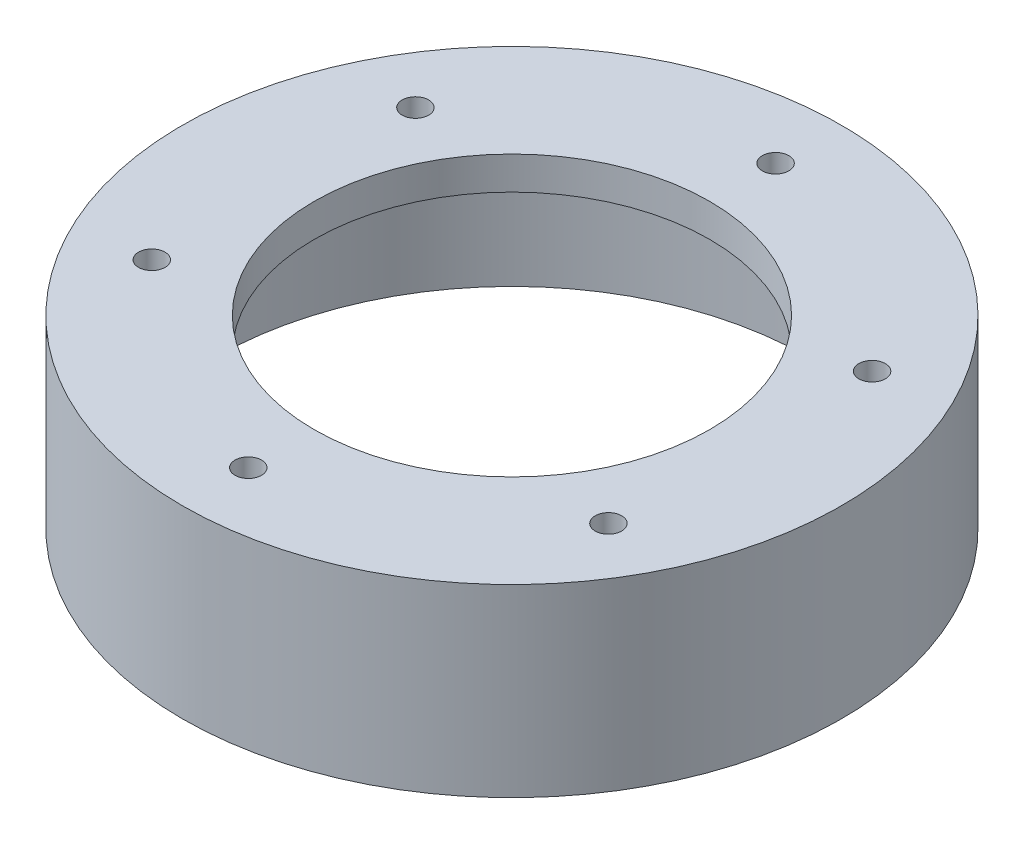
from build123d import *

# Parameters (mm, degrees)
SKETCH1_R              = 63.5
SKETCH1_R_2            = 38.1
BOSS_EXTRUDE1_DEPTH    = 35.56
SKETCH2_R              = 57.15
CUT_EXTRUDE1_DEPTH     = 29.21
F_10_CLEARANCE_HOLE1_D = 5.1054
CIRPATTERN1_COUNT      = 6


with BuildPart() as part:
    # Sketch1 → Boss-Extrude1 (new body)
    with BuildSketch(Plane(origin=(0, 0, 0), x_dir=(1, 0, 0), z_dir=(0, 1, 0))):
        with Locations(Location((0, 0, 0), (0, 0, 270))):
            Circle(SKETCH1_R)
        with Locations(Location((0, 0, 0), (0, 0, 270))):
            Circle(SKETCH1_R_2, mode=Mode.SUBTRACT)
    extrude(amount=BOSS_EXTRUDE1_DEPTH)

    # Sketch2 → Cut-Extrude1 (cut)
    with BuildSketch(Plane.XZ):
        with Locations(Location((0, 0, 0), (0, 0, 270))):
            Circle(SKETCH2_R)
    extrude(amount=-CUT_EXTRUDE1_DEPTH, mode=Mode.SUBTRACT)

    # #10 Clearance Hole1 (through all)
    with Locations(Plane(origin=(0, 35.56, 0), x_dir=(1, 0, 0), z_dir=(0, 1, 0))):
        with Locations((0, 50.8)):
            f_10_clearance_hole1 = Hole(F_10_CLEARANCE_HOLE1_D / 2)

    # CirPattern1: #10 Clearance Hole1 ×6 about axis
    cirpattern1_axis = Axis((0, 0, 0), (0, 1, 0))
    for i in range(1, CIRPATTERN1_COUNT):
        add(f_10_clearance_hole1.rotate(cirpattern1_axis, i * 360 / CIRPATTERN1_COUNT), mode=Mode.SUBTRACT)


solid = part.part
